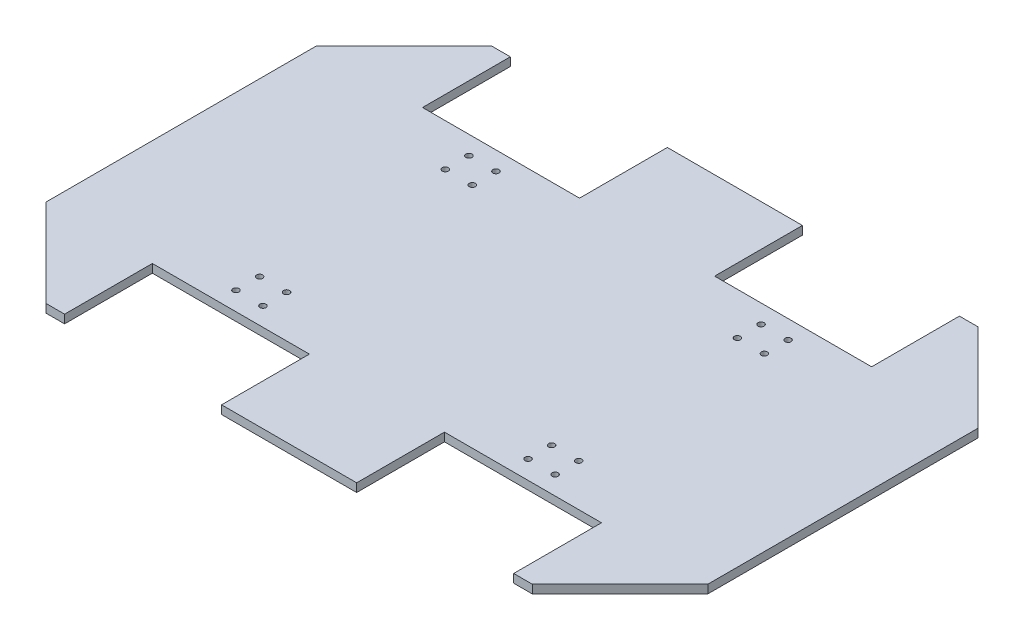
from build123d import *

# Parameters (mm, degrees)
SKETCH1_R           = 1.8
BOSS_EXTRUDE1_DEPTH = 5


with BuildPart() as part:
    # Sketch1 → Boss-Extrude1 (new body)
    with BuildSketch(Plane(origin=(0, 0, 0), x_dir=(1, 0, 0), z_dir=(0, 1, 0))):
        Polygon((196, -80), (196, 80), (144, 132), (133, 132), (133, 80), (40, 80), (40, 132), (-40, 132), (-40, 80), (-133, 80), (-133, 132), (-144, 132), (-196, 80), (-196, -80), (-144, -132), (-133, -132), (-133, -80), (-40, -80), (-40, -132), (40, -132), (40, -80), (133, -80), (133, -132), (144, -132), align=None)
        with Locations(Location((94.5, -69, 0), (0, 0, 270))):
            Circle(SKETCH1_R, mode=Mode.SUBTRACT)
        with Locations(Location((94.5, -55, 0), (0, 0, 90))):
            Circle(SKETCH1_R, mode=Mode.SUBTRACT)
        with Locations(Location((78.5, -69, 0), (0, 0, 90))):
            Circle(SKETCH1_R, mode=Mode.SUBTRACT)
        with Locations(Location((78.5, -55, 0), (0, 0, 270))):
            Circle(SKETCH1_R, mode=Mode.SUBTRACT)
        with Locations(Location((94.5, 69, 0), (0, 0, 90))):
            Circle(SKETCH1_R, mode=Mode.SUBTRACT)
        with Locations(Location((78.5, 69, 0), (0, 0, 270))):
            Circle(SKETCH1_R, mode=Mode.SUBTRACT)
        with Locations(Location((78.5, 55, 0), (0, 0, 90))):
            Circle(SKETCH1_R, mode=Mode.SUBTRACT)
        with Locations(Location((94.5, 55, 0), (0, 0, 270))):
            Circle(SKETCH1_R, mode=Mode.SUBTRACT)
        with Locations(Location((-94.5, -69, 0), (0, 0, 90))):
            Circle(SKETCH1_R, mode=Mode.SUBTRACT)
        with Locations(Location((-94.5, -55, 0), (0, 0, 270))):
            Circle(SKETCH1_R, mode=Mode.SUBTRACT)
        with Locations(Location((-78.5, -55, 0), (0, 0, 90))):
            Circle(SKETCH1_R, mode=Mode.SUBTRACT)
        with Locations(Location((-78.5, -69, 0), (0, 0, 270))):
            Circle(SKETCH1_R, mode=Mode.SUBTRACT)
        with Locations(Location((-78.5, 55, 0), (0, 0, 270))):
            Circle(SKETCH1_R, mode=Mode.SUBTRACT)
        with Locations(Location((-78.5, 69, 0), (0, 0, 90))):
            Circle(SKETCH1_R, mode=Mode.SUBTRACT)
        with Locations(Location((-94.5, 55, 0), (0, 0, 90))):
            Circle(SKETCH1_R, mode=Mode.SUBTRACT)
        with Locations(Location((-94.5, 69, 0), (0, 0, 270))):
            Circle(SKETCH1_R, mode=Mode.SUBTRACT)
    extrude(amount=BOSS_EXTRUDE1_DEPTH)


solid = part.part
